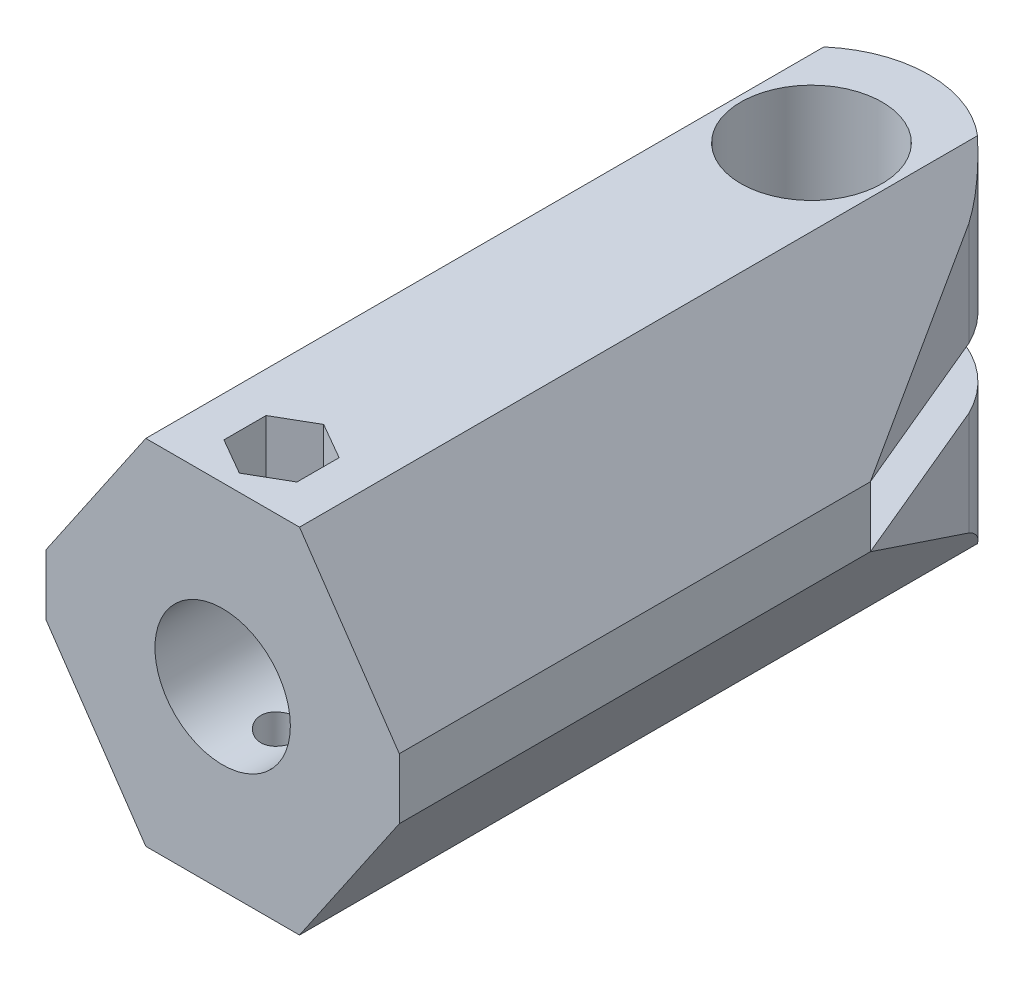
from build123d import *

# Parameters (mm, degrees)
SKETCH3_W            = 30
SKETCH3_H            = 30
BOSS_EXTRUDE1_DEPTH  = 40
CUT_EXTRUDE1_DEPTH   = 10
CUT_EXTRUDE2_DEPTH   = 5
CUT_EXTRUDE3_DEPTH   = 28
CUT_EXTRUDE4_START   = -40
CUT_EXTRUDE4_DEPTH   = 99.309519017
MIRROR5_START        = -40
MIRROR5_COPY_1_DEPTH = 99.309519017
SKETCH9_R            = 6
BOSS_EXTRUDE2_DEPTH  = 30
CUT_EXTRUDE5_DEPTH   = 30
SKETCH11_W           = 21.329134953
SKETCH11_H           = 5.145955698
CUT_EXTRUDE6_DEPTH   = 30


with BuildPart() as part:
    # Sketch3 → Boss-Extrude1 (new body)
    with BuildSketch(Plane.XY):
        with Locations((15, 15)):
            Rectangle(SKETCH3_W, SKETCH3_H)
    extrude(amount=BOSS_EXTRUDE1_DEPTH)

    # Sketch4 → Cut-Extrude1 (cut)
    with BuildSketch(Plane.XY.offset(40)):
        with BuildLine():
            ThreePointArc((20.75, 15), (17.200429736, 20.312307312), (10.934136008, 19.065863992))
            Line((10.934136008, 19.065863992), (19.065863992, 10.934136008))
            ThreePointArc((19.065863992, 10.934136008), (20.312307312, 12.799570264), (20.75, 15))
        make_face()
        with BuildLine():
            Line((19.065863992, 10.934136008), (10.934136008, 19.065863992))
            ThreePointArc((10.934136008, 19.065863992), (10.934136008, 10.934136008), (19.065863992, 10.934136008))
        make_face()
    extrude(amount=-CUT_EXTRUDE1_DEPTH, mode=Mode.SUBTRACT)

    # Sketch5 → Cut-Extrude2 (cut)
    with BuildSketch(Plane.XZ):
        Polygon((15, 38.58), (11.899629054, 36.79), (11.899629054, 33.21), (15, 31.42), (18.100370946, 33.21), (18.100370946, 36.79), align=None)
    cut_extrude2 = extrude(amount=-CUT_EXTRUDE2_DEPTH, mode=Mode.SUBTRACT)

    # Mirror1: Cut-Extrude2 across plane
    add(cut_extrude2.mirror(Plane(origin=(0, 15, 0), x_dir=(0, 0, 1), z_dir=(0, -1, 0))), mode=Mode.SUBTRACT)

    # Sketch6 → Cut-Extrude3 (cut)
    with BuildSketch(Plane(origin=(0, 25, 0), x_dir=(1, 0, 0), z_dir=(0, 1, 0))):
        with BuildLine():
            ThreePointArc((15, -33.25), (13.25, -35), (15, -36.75))
            Line((15, -36.75), (15, -33.25))
        make_face()
        with BuildLine():
            Line((15, -33.25), (15, -36.75))
            ThreePointArc((15, -36.75), (16.237436867, -36.237436867), (16.75, -35))
            ThreePointArc((16.75, -35), (16.237436867, -33.762563133), (15, -33.25))
        make_face()
    extrude(amount=-CUT_EXTRUDE3_DEPTH, mode=Mode.SUBTRACT)

    # Sketch8 → Cut-Extrude4 (cut)
    with BuildSketch(Plane(origin=(0, 0, 0), x_dir=(-1, 0, 0), z_dir=(0, 0, -1)).offset(CUT_EXTRUDE4_START)):
        Polygon((-77.236567429, -51.703622198), (-30, 17.572977849), (-21.526577959, 30), (25.70998947, 99.276600047), (-112.843210625, 193.749734905), (-215.789767524, 42.769512659), align=None)
    cut_extrude4 = extrude(amount=CUT_EXTRUDE4_DEPTH, mode=Mode.SUBTRACT)

    # Mirror4: Cut-Extrude4 across plane
    add(cut_extrude4.mirror(Plane.ZY.offset(-15)), mode=Mode.SUBTRACT)

    # Mirror5: Cut-Extrude4 across plane
    add(cut_extrude4.mirror(Plane(origin=(0, 15, 0), x_dir=(0, 0, 1), z_dir=(0, -1, 0))), mode=Mode.SUBTRACT)

    # Mirror5 copy 1 sketch → Mirror5 copy 1 (cut)
    with BuildSketch(Plane(origin=(30, 30, 0), x_dir=(1, 0, 0), z_dir=(0, 0, -1)).offset(MIRROR5_START)):
        Polygon((-77.236567429, -51.703622198), (-30, 17.572977849), (-21.526577959, 30), (25.70998947, 99.276600047), (-112.843210625, 193.749734905), (-215.789767524, 42.769512659), align=None)
    extrude(amount=MIRROR5_COPY_1_DEPTH, mode=Mode.SUBTRACT)

    # Sketch9 → Boss-Extrude2 (add)
    with BuildSketch(Plane(origin=(0, 0, 0), x_dir=(1, 0, 0), z_dir=(0, 1, 0))):
        with BuildLine():
            Line((5.769230769, 13.846153846), (0, 0))
            Line((0, 0), (30, 0))
            Line((30, 0), (24.424045098, 13.344753204))
            Line((24.424045098, 13.344753204), (24.002162862, 14.354430365))
            ThreePointArc((24.002162862, 14.354430365), (14.721339861, 19.996116672), (5.769230769, 13.846153846))
        make_face()
        with Locations(Location((15, 10, 0), (0, 0, 270))):
            Circle(SKETCH9_R, mode=Mode.SUBTRACT)
    extrude(amount=BOSS_EXTRUDE2_DEPTH)

    # Sketch10 → Cut-Extrude5 (cut)
    with BuildSketch(Plane.XY):
        Polygon((0, 17.572977849), (8.473422041, 30), (0, 30), align=None)
        Polygon((8.473422041, 0), (0, 0), (0, 12.427022151), align=None)
        Polygon((21.526577959, 0), (30, 12.427022151), (30, 0), align=None)
        Polygon((30, 17.572977849), (21.526577959, 30), (30, 30), align=None)
    extrude(amount=-CUT_EXTRUDE5_DEPTH, mode=Mode.SUBTRACT)

    # Sketch11 → Cut-Extrude6 (cut)
    with BuildSketch(Plane(origin=(30, 0, 0), x_dir=(0, 0, -1), z_dir=(1, 0, 0))):
        with Locations((10.664567477, 15)):
            Rectangle(SKETCH11_W, SKETCH11_H)
    extrude(amount=-CUT_EXTRUDE6_DEPTH, mode=Mode.SUBTRACT)


solid = part.part
